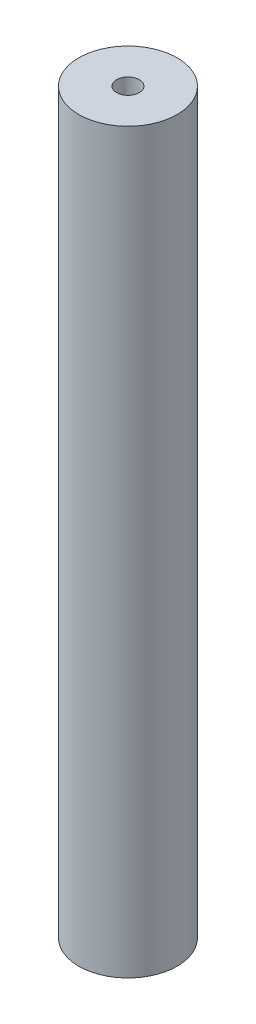
from build123d import *

# Parameters (mm, degrees)
SKETCH1_R           = 5
SKETCH1_R_2         = 1.15
BOSS_EXTRUDE1_DEPTH = 75


with BuildPart() as part:
    # Sketch1 → Boss-Extrude1 (new body)
    with BuildSketch(Plane(origin=(0, 0, 0), x_dir=(1, 0, 0), z_dir=(0, 1, 0))):
        with Locations(Location((0, 0, 0), (0, 0, 270))):
            Circle(SKETCH1_R)
        with Locations(Location((0, 0, 0), (0, 0, 270))):
            Circle(SKETCH1_R_2, mode=Mode.SUBTRACT)
    extrude(amount=BOSS_EXTRUDE1_DEPTH)


solid = part.part
